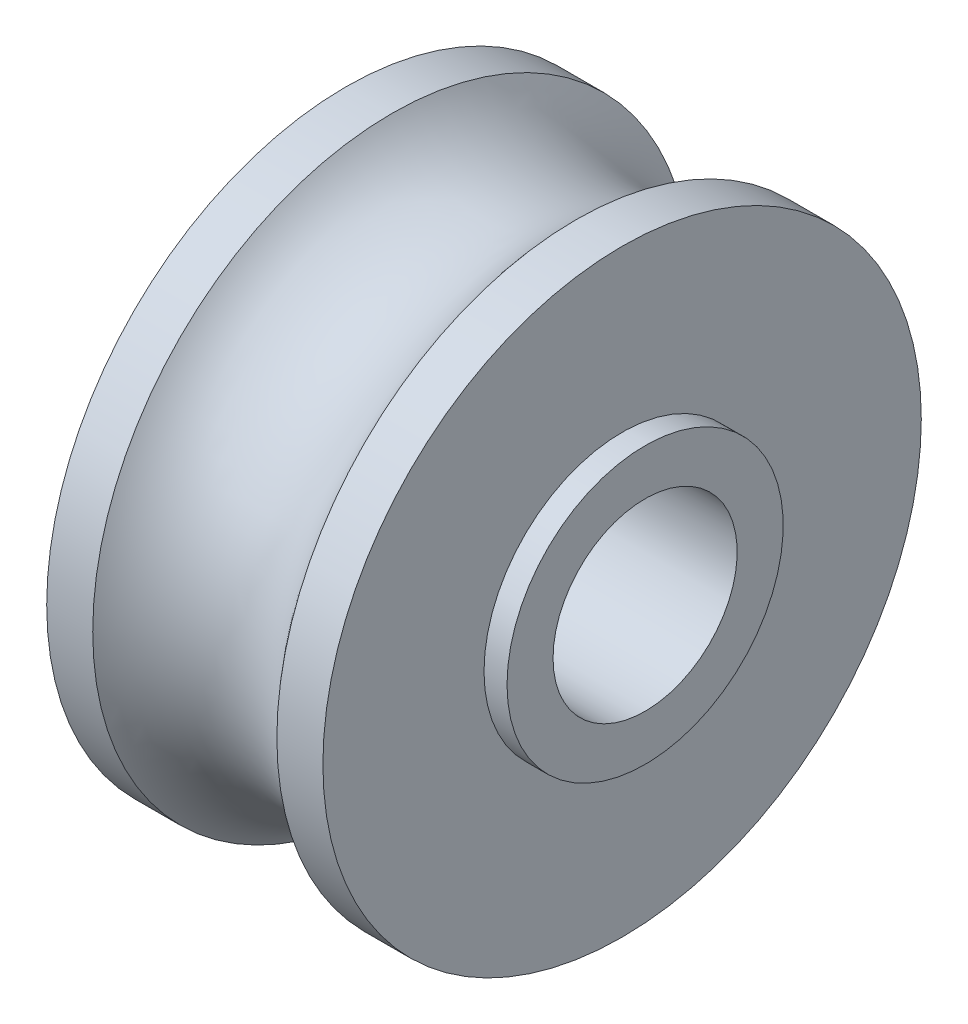
from build123d import *


with BuildPart() as part:
    # Esquisse1 → Révolution1 (revolve)
    with BuildSketch(Plane.XY, mode=Mode.PRIVATE) as r_volution1_sk:
        with BuildLine():
            Line((2, 6.5), (3, 6.5))
            Line((3, 6.5), (3, 3))
            Line((3, 3), (3.5, 3))
            Line((3.5, 3), (3.5, 2))
            Line((3.5, 2), (-3, 2))
            Line((-3, 2), (-3, 6.5))
            Line((-3, 6.5), (-2, 6.5))
            ThreePointArc((-2, 6.5), (0, 5.5), (2, 6.5))
        make_face()
    revolve(r_volution1_sk.sketch.rotate(Axis((0, 0, 0), (1, 0, 0)), 90), axis=Axis((0, 0, 0), (1, 0, 0)))


solid = part.part
